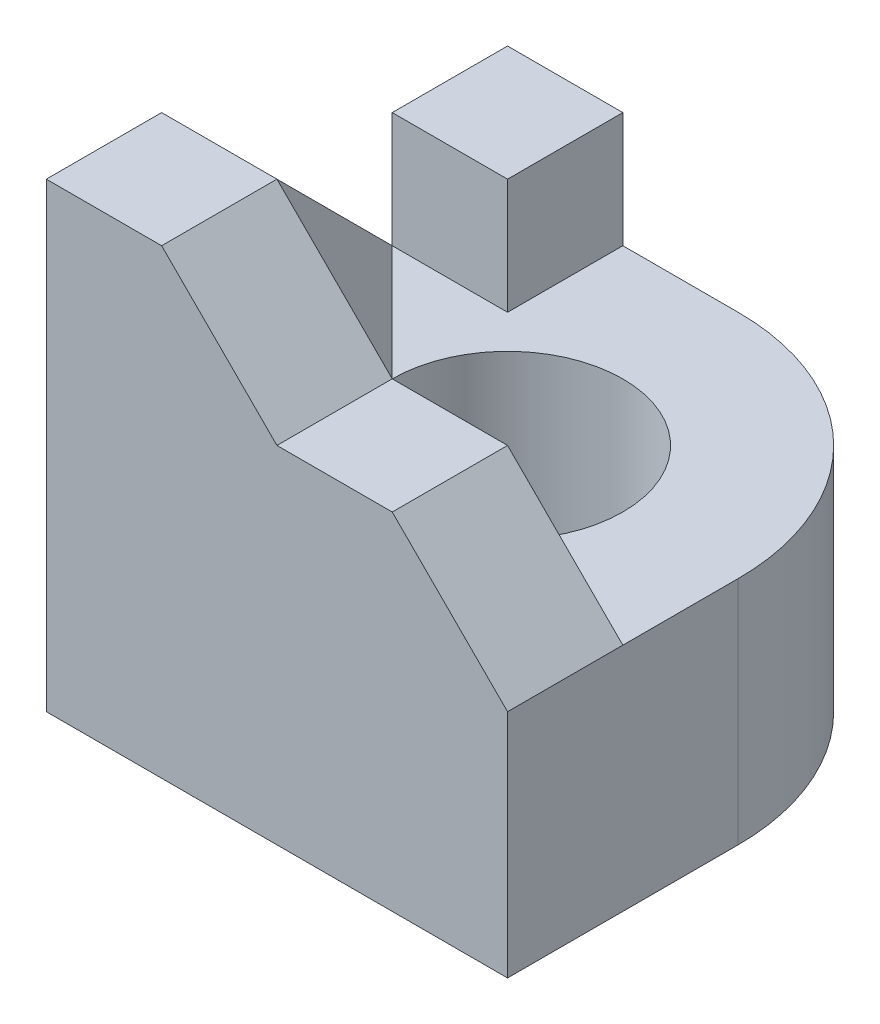
from build123d import *

# Parameters (mm, degrees)
SKETCH1_R           = 10
BOSS_EXTRUDE1_DEPTH = 20
SKETCH3_W           = 10
SKETCH3_H           = 10
BOSS_EXTRUDE2_DEPTH = 10
BOSS_EXTRUDE3_DEPTH = 10


with BuildPart() as part:
    # Sketch1 → Boss-Extrude1 (new body)
    with BuildSketch(Plane(origin=(0, 0, 0), x_dir=(1, 0, 0), z_dir=(0, 1, 0))):
        with BuildLine():
            Line((-20, -20), (-20, 20))
            Line((-20, 20), (0, 20))
            ThreePointArc((0, 20), (14.142135624, 14.142135624), (20, 0))
            Line((20, 0), (20, -20))
            Line((20, -20), (-20, -20))
        make_face()
        with Locations(Location((0, 0, 0), (0, 0, 270))):
            Circle(SKETCH1_R, mode=Mode.SUBTRACT)
    extrude(amount=BOSS_EXTRUDE1_DEPTH)

    # Sketch3 → Boss-Extrude2 (add)
    with BuildSketch(Plane.ZY.offset(20)):
        with Locations((-15, 25)):
            Rectangle(SKETCH3_W, SKETCH3_H)
        Polygon((20, 20), (20, 40), (10, 40), (0, 30), (0, 20), align=None)
    extrude(amount=-BOSS_EXTRUDE2_DEPTH)

    # Sketch4 → Boss-Extrude3 (add)
    with BuildSketch(Plane.XY.offset(20)):
        Polygon((-10, 40), (0, 30), (10, 30), (20, 20), (-10, 20), align=None)
    extrude(amount=-BOSS_EXTRUDE3_DEPTH)


solid = part.part
